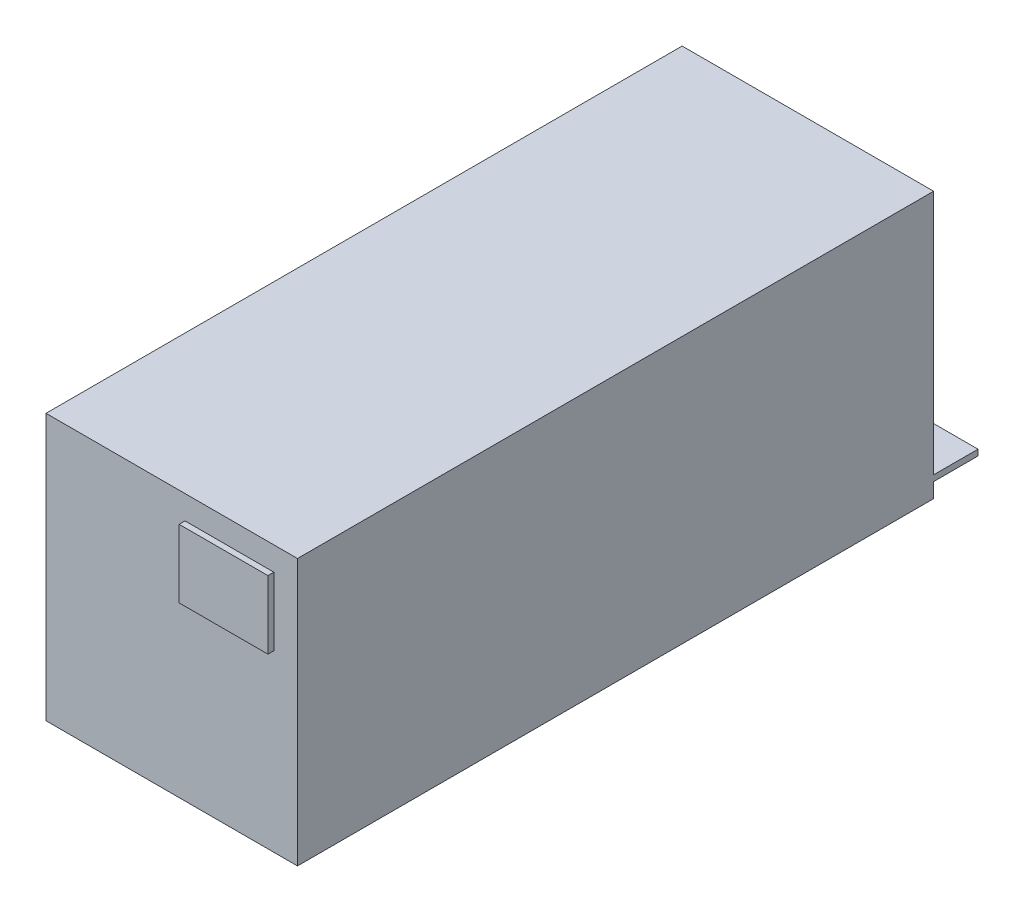
from build123d import *

# Parameters (mm, degrees)
SZKIC1_W                    = 85
SZKIC1_H                    = 90
DODANIE_WYCI_GNI_CIE1_DEPTH = 215
SZKIC2_W                    = 85
SZKIC2_H                    = 2
DODANIE_WYCI_GNI_CIE2_DEPTH = 15
SZKIC3_W                    = 30
SZKIC3_H                    = 23
DODANIE_WYCI_GNI_CIE3_DEPTH = 2


with BuildPart() as part:
    # Szkic1 → Dodanie-wyciągnięcie1 (new body)
    with BuildSketch(Plane.XY):
        Rectangle(SZKIC1_W, SZKIC1_H)
    extrude(amount=DODANIE_WYCI_GNI_CIE1_DEPTH)

    # Szkic2 → Dodanie-wyciągnięcie2 (add)
    with BuildSketch(Plane(origin=(0, 0, 0), x_dir=(-1, 0, 0), z_dir=(0, 0, -1))):
        with Locations((0, -39)):
            Rectangle(SZKIC2_W, SZKIC2_H)
    extrude(amount=DODANIE_WYCI_GNI_CIE2_DEPTH)

    # Szkic3 → Dodanie-wyciągnięcie3 (add)
    with BuildSketch(Plane.XY.offset(215)):
        with Locations((19.5, 25.5)):
            Rectangle(SZKIC3_W, SZKIC3_H)
    extrude(amount=DODANIE_WYCI_GNI_CIE3_DEPTH)


solid = part.part
